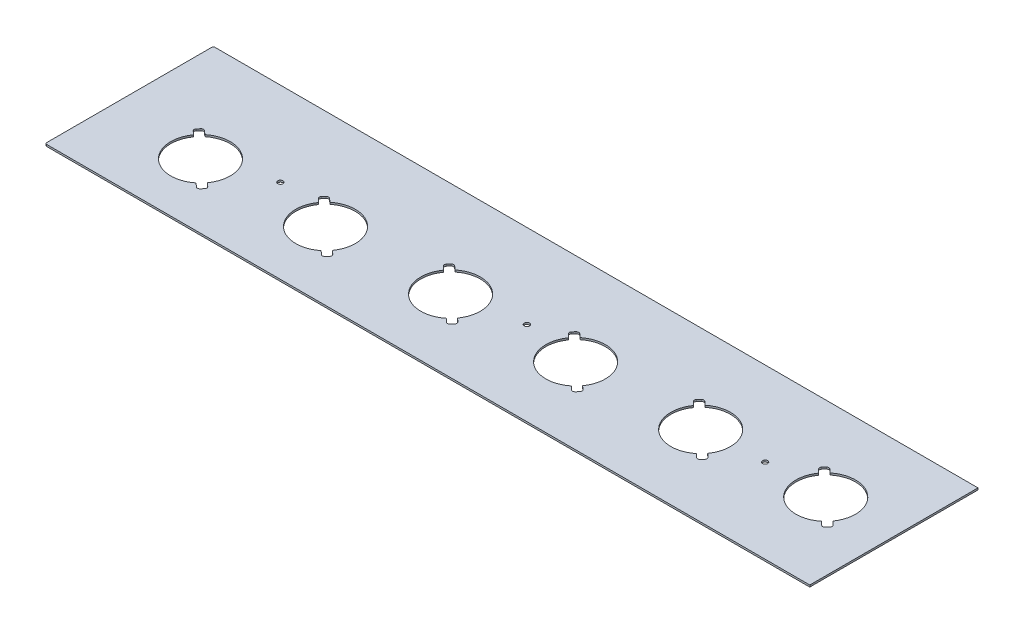
from build123d import *

# Parameters (mm, degrees)
SKETCH2_W             = 635
SKETCH2_H             = 139.7
BOSS_EXTRUDE1_DEPTH   = 1.524
FILLET1_R             = 1.27
F_8_CLEARANCE_HOLE1_D = 4.3053


with BuildPart() as part:
    # Sketch2 → Boss-Extrude1 (new body)
    with BuildSketch(Plane(origin=(0, 0, 0), x_dir=(1, 0, 0), z_dir=(0, 1, 0))):
        Rectangle(SKETCH2_W, SKETCH2_H)
        with BuildLine():
            Line((180.471121526, -17.560883985), (183.417760323, -20.322450333))
            ThreePointArc((183.417760323, -20.322450333), (184.049066919, -21.716938673), (183.509415933, -23.14939201))
            Line((183.509415933, -23.14939201), (181.663097836, -25.119445179))
            ThreePointArc((181.663097836, -25.119445179), (180.268609495, -25.750751775), (178.836156158, -25.211100788))
            Line((178.836156158, -25.211100788), (175.889517361, -22.44953444))
            ThreePointArc((175.889517361, -22.44953444), (143.413950131, -21.293785193), (140.156982214, 11.038712132))
            Line((140.156982214, 11.038712132), (137.210343417, 13.80027848))
            ThreePointArc((137.210343417, 13.80027848), (136.579036821, 15.194766821), (137.118687808, 16.627220158))
            Line((137.118687808, 16.627220158), (138.965005904, 18.597273327))
            ThreePointArc((138.965005904, 18.597273327), (140.359494245, 19.228579923), (141.791947582, 18.688928936))
            Line((141.791947582, 18.688928936), (144.738586379, 15.927362588))
            ThreePointArc((144.738586379, 15.927362588), (177.214153609, 14.77161334), (180.471121526, -17.560883985))
        make_face(mode=Mode.SUBTRACT)
        with BuildLine():
            Line((242.373895712, 21.950014862), (245.320534509, 19.188448514))
            ThreePointArc((245.320534509, 19.188448514), (277.796101739, 18.032699267), (281.053069656, -14.299798058))
            Line((281.053069656, -14.299798058), (283.999708453, -17.061364407))
            ThreePointArc((283.999708453, -17.061364407), (284.631015049, -18.455852747), (284.091364062, -19.888306084))
            Line((284.091364062, -19.888306084), (282.245045966, -21.858359253))
            ThreePointArc((282.245045966, -21.858359253), (280.850557625, -22.489665849), (279.418104288, -21.950014862))
            Line((279.418104288, -21.950014862), (276.471465491, -19.188448514))
            ThreePointArc((276.471465491, -19.188448514), (243.995898261, -18.032699267), (240.738930344, 14.299798058))
            Line((240.738930344, 14.299798058), (237.792291547, 17.061364407))
            ThreePointArc((237.792291547, 17.061364407), (237.160984951, 18.455852747), (237.700635938, 19.888306084))
            Line((237.700635938, 19.888306084), (239.546954034, 21.858359253))
            ThreePointArc((239.546954034, 21.858359253), (240.941442375, 22.489665849), (242.373895712, 21.950014862))
        make_face(mode=Mode.SUBTRACT)
        with BuildLine():
            Line((39.575034084, 7.777626206), (36.628395287, 10.539192554))
            ThreePointArc((36.628395287, 10.539192554), (35.997088691, 11.933680895), (36.536739678, 13.366134232))
            Line((36.536739678, 13.366134232), (38.383057774, 15.336187401))
            ThreePointArc((38.383057774, 15.336187401), (39.777546115, 15.967493997), (41.209999452, 15.42784301))
            Line((41.209999452, 15.42784301), (44.156638249, 12.666276662))
            ThreePointArc((44.156638249, 12.666276662), (76.632205479, 11.510527414), (79.889173396, -20.821969911))
            Line((79.889173396, -20.821969911), (82.835812193, -23.583536259))
            ThreePointArc((82.835812193, -23.583536259), (83.467118789, -24.9780246), (82.927467803, -26.410477937))
            Line((82.927467803, -26.410477937), (81.081149706, -28.380531105))
            ThreePointArc((81.081149706, -28.380531105), (79.686661366, -29.011837701), (78.254208028, -28.472186714))
            Line((78.254208028, -28.472186714), (75.307569231, -25.710620366))
            ThreePointArc((75.307569231, -25.710620366), (42.832002001, -24.554871119), (39.575034084, 7.777626206))
        make_face(mode=Mode.SUBTRACT)
        with BuildLine():
            Line((-61.006914046, 4.51654028), (-63.953552843, 7.278106628))
            ThreePointArc((-63.953552843, 7.278106628), (-64.584859439, 8.672594969), (-64.045208452, 10.105048306))
            Line((-64.045208452, 10.105048306), (-62.198890356, 12.075101475))
            ThreePointArc((-62.198890356, 12.075101475), (-60.804402015, 12.706408071), (-59.371948678, 12.166757084))
            Line((-59.371948678, 12.166757084), (-56.425309881, 9.405190735))
            ThreePointArc((-56.425309881, 9.405190735), (-23.949742651, 8.249441488), (-20.692774734, -24.083055837))
            Line((-20.692774734, -24.083055837), (-17.746135937, -26.844622185))
            ThreePointArc((-17.746135937, -26.844622185), (-17.114829341, -28.239110526), (-17.654480327, -29.671563863))
            Line((-17.654480327, -29.671563863), (-19.500798424, -31.641617031))
            ThreePointArc((-19.500798424, -31.641617031), (-20.895286764, -32.272923627), (-22.327740102, -31.73327264))
            Line((-22.327740102, -31.73327264), (-25.274378899, -28.971706292))
            ThreePointArc((-25.274378899, -28.971706292), (-57.749946129, -27.815957045), (-61.006914046, 4.51654028))
        make_face(mode=Mode.SUBTRACT)
        with BuildLine():
            Line((-161.588862176, 1.255454354), (-164.535500973, 4.017020702))
            ThreePointArc((-164.535500973, 4.017020702), (-165.166807569, 5.411509043), (-164.627156582, 6.84396238))
            Line((-164.627156582, 6.84396238), (-162.780838486, 8.814015548))
            ThreePointArc((-162.780838486, 8.814015548), (-161.386350145, 9.445322144), (-159.953896808, 8.905671157))
            Line((-159.953896808, 8.905671157), (-157.007258011, 6.144104809))
            ThreePointArc((-157.007258011, 6.144104809), (-124.53169078, 4.988355562), (-121.274722864, -27.344141763))
            Line((-121.274722864, -27.344141763), (-118.328084067, -30.105708111))
            ThreePointArc((-118.328084067, -30.105708111), (-117.696777471, -31.500196452), (-118.236428457, -32.932649789))
            Line((-118.236428457, -32.932649789), (-120.082746554, -34.902702958))
            ThreePointArc((-120.082746554, -34.902702958), (-121.477234894, -35.534009554), (-122.909688232, -34.994358567))
            Line((-122.909688232, -34.994358567), (-125.856327029, -32.232792218))
            ThreePointArc((-125.856327029, -32.232792218), (-158.331894259, -31.077042971), (-161.588862176, 1.255454354))
        make_face(mode=Mode.SUBTRACT)
        with BuildLine():
            Line((-221.856670994, -30.605227689), (-218.910032197, -33.366794037))
            ThreePointArc((-218.910032197, -33.366794037), (-218.2787256, -34.761282378), (-218.818376587, -36.193735715))
            Line((-218.818376587, -36.193735715), (-220.664694684, -38.163788884))
            ThreePointArc((-220.664694684, -38.163788884), (-222.059183024, -38.79509548), (-223.491636361, -38.255444493))
            Line((-223.491636361, -38.255444493), (-226.438275159, -35.493878145))
            ThreePointArc((-226.438275159, -35.493878145), (-258.913842389, -34.338128897), (-262.170810306, -2.005631572))
            Line((-262.170810306, -2.005631572), (-265.117449103, 0.755934776))
            ThreePointArc((-265.117449103, 0.755934776), (-265.748755699, 2.150423117), (-265.209104712, 3.582876454))
            Line((-265.209104712, 3.582876454), (-263.362786616, 5.552929622))
            ThreePointArc((-263.362786616, 5.552929622), (-261.968298275, 6.184236218), (-260.535844938, 5.644585231))
            Line((-260.535844938, 5.644585231), (-257.589206141, 2.883018883))
            ThreePointArc((-257.589206141, 2.883018883), (-225.11363891, 1.727269636), (-221.856670994, -30.605227689))
        make_face(mode=Mode.SUBTRACT)
    extrude(amount=BOSS_EXTRUDE1_DEPTH)

    # Fillet1
    fillet1_edges = [part.edges().sort_by_distance(p)[0] for p in [
        (-317.5, 0.762, 69.85),
        (-317.5, 0.762, -69.85),
    ]]
    fillet(fillet1_edges, radius=FILLET1_R)

    # #8 Clearance Hole1 (through all)
    with Locations(Plane(origin=(0, 1.524, 0), x_dir=(1, 0, 0), z_dir=(0, 1, 0))):
        with Locations((210.5786, 0), (12.7, 0), (-191.9606, 0)):
            Hole(F_8_CLEARANCE_HOLE1_D / 2)


solid = part.part
